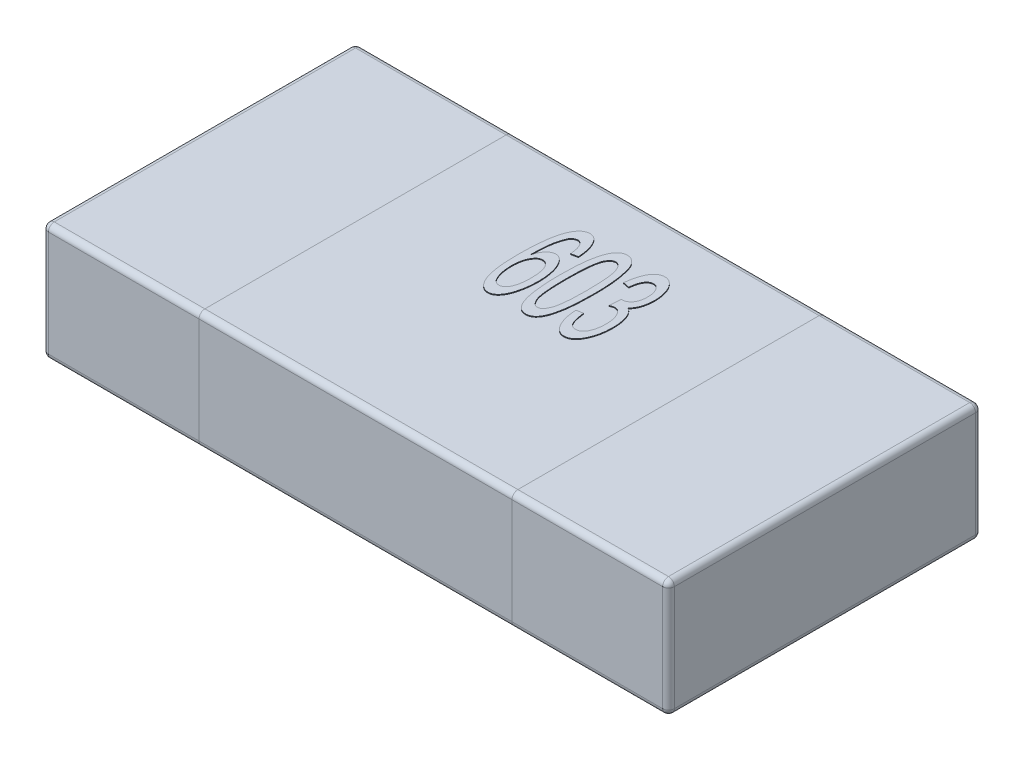
from build123d import *

# Parameters (mm, degrees)
SKETCH1_W      = 1.6
SKETCH1_H      = 0.8
EXTRUDE1_DEPTH = 0.3
FILLET1_R      = 0.015
EXTRUDE2_DEPTH = 0.002


with BuildPart() as part:
    # Sketch1 → Extrude1 (new body)
    with BuildSketch(Plane(origin=(0, 0, 0), x_dir=(1, 0, 0), z_dir=(0, 1, 0))):
        Rectangle(SKETCH1_W, SKETCH1_H)
    extrude(amount=EXTRUDE1_DEPTH)

    # Fillet1
    fillet1_edges = [part.edges().sort_by_distance(p)[0] for p in [
        (0.8, 0.3, 0),
        (0, 0.3, -0.4),
        (-0.8, 0.3, 0),
        (0, 0, -0.4),
        (0.8, 0, 0),
        (0, 0, 0.4),
        (-0.8, 0, 0),
        (0, 0.3, 0.4),
        (-0.8, 0.15, -0.4),
        (0.8, 0.15, -0.4),
        (0.8, 0.15, 0.4),
        (-0.8, 0.15, 0.4),
    ]]
    fillet(fillet1_edges, radius=FILLET1_R)

    # Sketch3 → Extrude2 (add)
    # profile 1 of 3: a face of its own
    with BuildSketch(Plane(origin=(0, 0.3, 0), x_dir=(1, 0, 0), z_dir=(0, 1, 0))):
        with BuildLine():
            Line((-0.036096661, 0.205977543), (-0.052560242, 0.202684827))
            add(Edge.make_bspline(
                [(-0.052560242, 0.202684827), (-0.052916238, 0.205500322), (-0.053578199, 0.210735634), (-0.054805569, 0.217971194), (-0.056350024, 0.223970927), (-0.057710724, 0.227458527), (-0.058322496, 0.229026557)],
                knots=[0, 0, 0, 0, 1.25871191, 2.340529116, 3.253899801, 4, 4, 4, 4], degree=3))
            add(Edge.make_bspline(
                [(-0.058322496, 0.229026557), (-0.058840285, 0.230062546), (-0.059826197, 0.232035155), (-0.061459633, 0.234760556), (-0.063271034, 0.237013087), (-0.065122747, 0.238914427), (-0.067090975, 0.240365286), (-0.069145695, 0.24144233), (-0.071319016, 0.242074823), (-0.072810043, 0.242156711), (-0.073551308, 0.242197422)],
                knots=[0, 0, 0, 0, 1.306213246, 2.487137382, 3.574554826, 4.559249402, 5.472188151, 6.319898977, 7.164736574, 8, 8, 8, 8], degree=3))
            add(Edge.make_bspline(
                [(-0.073551308, 0.242197422), (-0.07476618, 0.242107786), (-0.077278827, 0.241922398), (-0.080942431, 0.240323688), (-0.084612853, 0.237923041), (-0.086794531, 0.235744014), (-0.087956942, 0.234583016)],
                knots=[0, 0, 0, 0, 0.867949308, 1.795127324, 2.825230866, 4, 4, 4, 4], degree=3))
            add(Edge.make_bspline(
                [(-0.087956942, 0.234583016), (-0.088883615, 0.232763597), (-0.090885164, 0.228833778), (-0.093327859, 0.222137746), (-0.09569384, 0.214361846), (-0.097435328, 0.207108129), (-0.098743078, 0.200598815), (-0.099531474, 0.194978002), (-0.100244908, 0.188767584), (-0.100872077, 0.181976016), (-0.101308082, 0.174597013), (-0.10168483, 0.16662258), (-0.101869339, 0.158045302), (-0.1019232, 0.152127963), (-0.101950986, 0.14907529)],
                knots=[0, 0, 0, 0, 0.839911614, 1.814150845, 2.928592173, 4.18546405, 4.883305264, 5.661100017, 6.521068196, 7.456841163, 8.468429487, 9.563856538, 10.743227272, 12, 12, 12, 12], degree=3))
            add(Edge.make_bspline(
                [(-0.101950986, 0.14907529), (-0.100981266, 0.151766974), (-0.099142888, 0.156869817), (-0.095883014, 0.163875714), (-0.092224423, 0.169757395), (-0.08826603, 0.17454885), (-0.084068651, 0.178257141), (-0.07977594, 0.180948914), (-0.075317364, 0.182628825), (-0.072278537, 0.182829242), (-0.070773079, 0.182928529)],
                knots=[0, 0, 0, 0, 1.402270684, 2.658397633, 3.780438484, 4.789116074, 5.694730099, 6.51377897, 7.263714787, 8, 8, 8, 8], degree=3))
            add(Edge.make_bspline(
                [(-0.070773079, 0.182928529), (-0.069480331, 0.182857163), (-0.066883945, 0.182713828), (-0.063071578, 0.181604616), (-0.059485106, 0.179664998), (-0.055979674, 0.177128289), (-0.052718801, 0.173775203), (-0.049542654, 0.169772586), (-0.046586994, 0.165005793), (-0.043797521, 0.159574745), (-0.041183113, 0.153607508), (-0.038919576, 0.147140394), (-0.037025945, 0.140244694), (-0.035505037, 0.132919319), (-0.034258803, 0.125196618), (-0.033399298, 0.117038908), (-0.032876379, 0.10845497), (-0.03282845, 0.102583597), (-0.032803945, 0.099581649)],
                knots=[0, 0, 0, 0, 0.625603928, 1.256478042, 1.902851609, 2.592240709, 3.343949749, 4.15981504, 5.063070217, 6.054883205, 7.114906339, 8.215506121, 9.370060925, 10.575444375, 11.837083261, 13.156892884, 14.546360702, 16, 16, 16, 16], degree=3))
            add(Edge.make_bspline(
                [(-0.032803945, 0.099581649), (-0.032850682, 0.095617426), (-0.032942504, 0.08782929), (-0.03403992, 0.076357911), (-0.035638859, 0.065301191), (-0.037932498, 0.0547981), (-0.040756457, 0.045106297), (-0.044054038, 0.036461454), (-0.047891247, 0.029016938), (-0.052264038, 0.022856687), (-0.056982358, 0.017905703), (-0.062134763, 0.014354566), (-0.067642363, 0.01207195), (-0.071489984, 0.011828128), (-0.073396962, 0.011707284)],
                knots=[0, 0, 0, 0, 1.358661427, 2.669234055, 3.94728783, 5.187061561, 6.351710887, 7.405369735, 8.354785955, 9.214625863, 9.987975468, 10.685974054, 11.348735509, 12, 12, 12, 12], degree=3))
            add(Edge.make_bspline(
                [(-0.073396962, 0.011707284), (-0.075035193, 0.011798371), (-0.078281696, 0.011978879), (-0.083011275, 0.013373256), (-0.087447542, 0.015704858), (-0.091647133, 0.018906395), (-0.09564022, 0.022968277), (-0.099334051, 0.027985382), (-0.102813412, 0.033869295), (-0.106076879, 0.040674271), (-0.109014183, 0.048518609), (-0.111553474, 0.057485011), (-0.11369634, 0.06761075), (-0.115402755, 0.078901292), (-0.116786852, 0.091343464), (-0.117740633, 0.104954002), (-0.118292934, 0.119710594), (-0.118373046, 0.129935885), (-0.118414567, 0.135235592)],
                knots=[0, 0, 0, 0, 0.552617799, 1.095129805, 1.649413991, 2.236632648, 2.871359374, 3.566291345, 4.335003942, 5.176807573, 6.111491792, 7.159920783, 8.320743804, 9.604187918, 11.014329628, 12.547134295, 14.21040025, 16, 16, 16, 16], degree=3))
            add(Edge.make_bspline(
                [(-0.118414567, 0.135235592), (-0.118383327, 0.14118725), (-0.118323074, 0.152665905), (-0.11763298, 0.169255859), (-0.116586134, 0.184580864), (-0.115100659, 0.198653553), (-0.113255858, 0.211475597), (-0.110868853, 0.223025396), (-0.108207838, 0.233369508), (-0.105811451, 0.239676667), (-0.104677767, 0.24266046)],
                knots=[0, 0, 0, 0, 1.311918811, 2.530229781, 3.659611045, 4.697492828, 5.649171826, 6.513674335, 7.296848314, 8, 8, 8, 8], degree=3))
            add(Edge.make_bspline(
                [(-0.104677767, 0.24266046), (-0.103670777, 0.244960209), (-0.101754681, 0.24933616), (-0.098395926, 0.255320297), (-0.094780099, 0.260404284), (-0.090823353, 0.264520867), (-0.086661668, 0.267805335), (-0.082196842, 0.270172333), (-0.077405454, 0.27155828), (-0.074125923, 0.271740108), (-0.072470886, 0.271831868)],
                knots=[0, 0, 0, 0, 1.302959035, 2.479264578, 3.556888232, 4.533046998, 5.434321766, 6.298634537, 7.14139415, 8, 8, 8, 8], degree=3))
            add(Edge.make_bspline(
                [(-0.072470886, 0.271831868), (-0.071231113, 0.271789034), (-0.068791359, 0.271704741), (-0.065214001, 0.270829239), (-0.061819597, 0.269436687), (-0.058577599, 0.267513615), (-0.055589554, 0.264987155), (-0.052732722, 0.261974989), (-0.050061315, 0.258390048), (-0.047566135, 0.254282219), (-0.045258653, 0.249707538), (-0.04319491, 0.24468558), (-0.041417962, 0.239245226), (-0.039876535, 0.233383334), (-0.038545731, 0.227135374), (-0.037463978, 0.220456584), (-0.036655429, 0.213363881), (-0.036286181, 0.208482797), (-0.036096661, 0.205977543)],
                knots=[0, 0, 0, 0, 0.72398594, 1.42473555, 2.140052362, 2.864316225, 3.619526472, 4.42133265, 5.28803078, 6.229094356, 7.229502414, 8.28201401, 9.401785489, 10.574578382, 11.825867737, 13.136926968, 14.530506016, 16, 16, 16, 16], degree=3))
        make_face()
        with BuildLine():
            add(Edge.make_bspline(
                [(-0.101950986, 0.100250482), (-0.101924104, 0.097675728), (-0.101870947, 0.092584281), (-0.101062343, 0.085036357), (-0.100056853, 0.077631012), (-0.098455251, 0.070522494), (-0.096538086, 0.063945666), (-0.094423279, 0.058056664), (-0.091932097, 0.053061404), (-0.089316523, 0.048796777), (-0.086240722, 0.045461704), (-0.082757775, 0.043054332), (-0.078823864, 0.041586576), (-0.076050438, 0.041424591), (-0.074631731, 0.04134173)],
                knots=[0, 0, 0, 0, 1.31091918, 2.592277792, 3.863620146, 5.11633554, 6.299587734, 7.352780662, 8.298286836, 9.139203598, 9.893267991, 10.591138217, 11.27931686, 12, 12, 12, 12], degree=3))
            add(Edge.make_bspline(
                [(-0.074631731, 0.04134173), (-0.073648944, 0.041390981), (-0.071724611, 0.041487418), (-0.068930079, 0.042261399), (-0.066277889, 0.043427265), (-0.063839102, 0.045167588), (-0.061616591, 0.047392282), (-0.059476762, 0.050016973), (-0.057608866, 0.053199182), (-0.055855117, 0.056788927), (-0.0543503, 0.060818468), (-0.052937558, 0.065166106), (-0.0518388, 0.06990801), (-0.050840225, 0.074963046), (-0.050148946, 0.080379252), (-0.049630757, 0.086127965), (-0.049324155, 0.09222115), (-0.049286702, 0.096408639), (-0.049267526, 0.098552675)],
                knots=[0, 0, 0, 0, 0.688942626, 1.348976093, 2.022597512, 2.714060669, 3.437792542, 4.225685194, 5.084703878, 6.021697538, 7.027924231, 8.101756653, 9.229005186, 10.442766564, 11.718204999, 13.060110705, 14.494747648, 16, 16, 16, 16], degree=3))
            add(Edge.make_bspline(
                [(-0.049267526, 0.098552675), (-0.049286144, 0.100611042), (-0.049322472, 0.104627291), (-0.049637673, 0.110496735), (-0.05013548, 0.116025419), (-0.050858089, 0.121210613), (-0.051778825, 0.126054644), (-0.052897886, 0.130576791), (-0.054228499, 0.134758115), (-0.05577248, 0.138577961), (-0.057488692, 0.142028574), (-0.059451818, 0.145023464), (-0.061564343, 0.147592124), (-0.063907456, 0.149700086), (-0.066496005, 0.151300104), (-0.069264617, 0.152427404), (-0.072204414, 0.153217224), (-0.074248975, 0.153267978), (-0.075300564, 0.153294083)],
                knots=[0, 0, 0, 0, 1.478732979, 2.885278326, 4.221645226, 5.465767645, 6.644990639, 7.762613673, 8.810773448, 9.794608648, 10.720329775, 11.574669169, 12.361868475, 13.103694743, 13.828546177, 14.535586313, 15.246800971, 16, 16, 16, 16], degree=3))
            add(Edge.make_bspline(
                [(-0.075300564, 0.153294083), (-0.076215167, 0.153264412), (-0.078039831, 0.153205218), (-0.080686643, 0.152415784), (-0.083250725, 0.151288823), (-0.085685097, 0.149652878), (-0.088015119, 0.147585624), (-0.090171426, 0.14500143), (-0.092285489, 0.142016496), (-0.094991928, 0.137330259), (-0.097874399, 0.130593101), (-0.100229861, 0.121472417), (-0.101749343, 0.111242611), (-0.101881665, 0.10402935), (-0.101950986, 0.100250482)],
                knots=[0, 0, 0, 0, 0.50721352, 1.011907156, 1.524478714, 2.061771768, 2.63633205, 3.252202119, 3.930018688, 4.669826361, 6.259948316, 7.98914141, 9.898800059, 12, 12, 12, 12], degree=3))
        make_face(mode=Mode.SUBTRACT)
    # profile 2 of 3: a face of its own
    with BuildSketch(Plane(origin=(0, 0.3, 0), x_dir=(1, 0, 0), z_dir=(0, 1, 0))):
        with BuildLine():
            add(Edge.make_bspline(
                [(-0.01963308, 0.141666679), (-0.0196336, 0.145336921), (-0.01963462, 0.152524056), (-0.019338671, 0.163036587), (-0.019007755, 0.173020239), (-0.018487824, 0.18247128), (-0.017831025, 0.191391928), (-0.0170105, 0.199798121), (-0.016038147, 0.207673148), (-0.01491577, 0.215053), (-0.013609664, 0.221942574), (-0.012269607, 0.228397635), (-0.010631666, 0.234368012), (-0.008985003, 0.23991699), (-0.007101043, 0.245008279), (-0.005125272, 0.249651995), (-0.003016409, 0.253887417), (-0.00069761, 0.257618657), (0.00171757, 0.260980349), (0.004362167, 0.263835085), (0.007063973, 0.266380117), (0.010042242, 0.268311931), (0.013102296, 0.269892558), (0.016315504, 0.271035492), (0.019695286, 0.271729092), (0.022002776, 0.2717973), (0.023172232, 0.271831868)],
                knots=[0, 0, 0, 0, 1.788151203, 3.501590505, 5.123661968, 6.655046519, 8.113000155, 9.481534149, 10.769784636, 11.978715488, 13.117706418, 14.186263485, 15.189545838, 16.133154468, 17.005520955, 17.83278295, 18.59136407, 19.307915781, 19.971396443, 20.60428632, 21.201766662, 21.774181656, 22.327241785, 22.876946358, 23.430826444, 24, 24, 24, 24], degree=3))
            add(Edge.make_bspline(
                [(0.023172232, 0.271831868), (0.02489742, 0.271730261), (0.028365554, 0.271526), (0.033436322, 0.269931461), (0.038179705, 0.267181372), (0.042730219, 0.263593923), (0.046826031, 0.258957748), (0.050487109, 0.253444342), (0.053413024, 0.246934772), (0.055851925, 0.239571048), (0.057917698, 0.231350487), (0.059793333, 0.222297662), (0.061561708, 0.212402778), (0.062781594, 0.203568218), (0.063780502, 0.195940553), (0.064297629, 0.189619371), (0.064818017, 0.182811559), (0.065302136, 0.175524877), (0.065588826, 0.167752811), (0.065780113, 0.15950283), (0.065953973, 0.150756638), (0.065969539, 0.144753696), (0.065977543, 0.141666679)],
                knots=[0, 0, 0, 0, 0.698737742, 1.404667979, 2.12995161, 2.911751777, 3.743784079, 4.626968618, 5.585054768, 6.627217942, 7.768858967, 9.019282369, 10.374969805, 11.84297779, 12.634639747, 13.493234909, 14.413621191, 15.402885648, 16.453571879, 17.566351522, 18.748494617, 20, 20, 20, 20], degree=3))
            add(Edge.make_bspline(
                [(0.065977543, 0.141666679), (0.065978159, 0.138013585), (0.065979362, 0.130877887), (0.065683866, 0.120451066), (0.065349023, 0.110536192), (0.064834878, 0.101136305), (0.064173184, 0.092233069), (0.063353211, 0.083844319), (0.062389542, 0.075967503), (0.061239517, 0.068613544), (0.060041688, 0.061718903), (0.058565673, 0.055298878), (0.057068806, 0.049292549), (0.055352217, 0.043751556), (0.053514096, 0.038644463), (0.051503855, 0.033981437), (0.049430118, 0.029711033), (0.047075739, 0.025966705), (0.044691828, 0.022568395), (0.042054501, 0.019695347), (0.039301385, 0.017240817), (0.036408438, 0.015185704), (0.03329965, 0.013666592), (0.030067263, 0.012491487), (0.026664654, 0.011815784), (0.024341232, 0.011743601), (0.023172232, 0.011707284)],
                knots=[0, 0, 0, 0, 1.782030605, 3.480894169, 5.088281126, 6.621588788, 8.07303046, 9.443283057, 10.733151328, 11.943600354, 13.074282689, 14.145979223, 15.156496006, 16.093291734, 16.974611604, 17.802912475, 18.569920005, 19.28737156, 19.958446926, 20.592131586, 21.184778595, 21.755709941, 22.316934963, 22.867329855, 23.430111676, 24, 24, 24, 24], degree=3))
            add(Edge.make_bspline(
                [(0.023172232, 0.011707284), (0.021622309, 0.011792751), (0.018566274, 0.011961269), (0.014103824, 0.013116829), (0.009957796, 0.015110453), (0.00606522, 0.017874768), (0.002410954, 0.021382612), (-0.000910612, 0.025720225), (-0.004048152, 0.030755113), (-0.005766959, 0.034494046), (-0.006668009, 0.036454104)],
                knots=[0, 0, 0, 0, 0.902837177, 1.780155013, 2.665121303, 3.568842748, 4.551176045, 5.604575603, 6.744247641, 8, 8, 8, 8], degree=3))
            add(Edge.make_bspline(
                [(-0.006668009, 0.036454104), (-0.007728683, 0.039423115), (-0.009969715, 0.045696156), (-0.012473652, 0.055911974), (-0.014784141, 0.067263449), (-0.016504813, 0.079849027), (-0.017971067, 0.093605873), (-0.018884545, 0.108575532), (-0.0195315, 0.124717181), (-0.019598439, 0.135886533), (-0.01963308, 0.141666679)],
                knots=[0, 0, 0, 0, 0.709939903, 1.499988449, 2.366908435, 3.319380224, 4.360574811, 5.483543829, 6.697732639, 8, 8, 8, 8], degree=3))
        make_face()
        with BuildLine():
            add(Edge.make_bspline(
                [(-0.003169498, 0.141769576), (-0.003155073, 0.136830283), (-0.00312747, 0.127378965), (-0.002776126, 0.113878478), (-0.002162817, 0.101699054), (-0.001350557, 0.090873669), (-0.00038631, 0.081369297), (0.000962794, 0.073217333), (0.00244151, 0.066378302), (0.004194866, 0.060755793), (0.006247958, 0.056180954), (0.008251675, 0.05222923), (0.010496578, 0.048939222), (0.012731745, 0.046139662), (0.015171562, 0.043997946), (0.017726372, 0.042457926), (0.020418136, 0.041532712), (0.022256604, 0.041405224), (0.023172232, 0.04134173)],
                knots=[0, 0, 0, 0, 2.148209171, 4.110589266, 5.873159013, 7.451500976, 8.832018525, 10.026371285, 11.043326014, 11.87364374, 12.581766074, 13.222361835, 13.797470004, 14.311267183, 14.776476503, 15.201174402, 15.602154233, 16, 16, 16, 16], degree=3))
            add(Edge.make_bspline(
                [(0.023172232, 0.04134173), (0.024087316, 0.041406165), (0.025924693, 0.041535541), (0.028633345, 0.042449085), (0.031159233, 0.044057252), (0.033595097, 0.046185941), (0.035871262, 0.048927244), (0.038026135, 0.052250549), (0.040065479, 0.056188001), (0.042082893, 0.060820062), (0.043903713, 0.066439134), (0.04540722, 0.073297012), (0.046637216, 0.081465469), (0.047722003, 0.090954084), (0.048500412, 0.101768616), (0.049121855, 0.113912487), (0.049471924, 0.127396187), (0.049499516, 0.136830309), (0.049513962, 0.141769576)],
                knots=[0, 0, 0, 0, 0.397968213, 0.799071455, 1.227748287, 1.693100786, 2.201337741, 2.77249547, 3.413288389, 4.128472313, 4.968442944, 5.978433683, 7.179335303, 8.561103895, 10.132491914, 11.895604132, 13.851129669, 16, 16, 16, 16], degree=3))
            add(Edge.make_bspline(
                [(0.049513962, 0.141769576), (0.049500878, 0.146606023), (0.049475821, 0.155868822), (0.049106136, 0.169110662), (0.048551179, 0.181084137), (0.047812005, 0.191793744), (0.046802511, 0.201234544), (0.045573813, 0.209405715), (0.044212587, 0.216323276), (0.042462554, 0.222047621), (0.040612722, 0.226846565), (0.038513124, 0.230874839), (0.036406114, 0.234360491), (0.034048642, 0.237203159), (0.031549104, 0.239441387), (0.028847838, 0.241049155), (0.025980945, 0.242016447), (0.024002391, 0.242137291), (0.023017886, 0.242197422)],
                knots=[0, 0, 0, 0, 2.097667638, 4.017468331, 5.745104336, 7.296299201, 8.673017144, 9.86175774, 10.880024204, 11.727147521, 12.455080493, 13.107114618, 13.695308986, 14.218167368, 14.703088503, 15.143210123, 15.573671531, 16, 16, 16, 16], degree=3))
            add(Edge.make_bspline(
                [(0.023017886, 0.242197422), (0.02210265, 0.242152013), (0.020268471, 0.242061011), (0.017588327, 0.241181388), (0.015056215, 0.239768087), (0.01262728, 0.237811532), (0.010415289, 0.235255535), (0.00820768, 0.232231492), (0.006174796, 0.228633061), (0.005004618, 0.225984995), (0.004393459, 0.22460197)],
                knots=[0, 0, 0, 0, 0.80675324, 1.616773564, 2.464611733, 3.359239115, 4.357250525, 5.442463065, 6.664255618, 8, 8, 8, 8], degree=3))
            add(Edge.make_bspline(
                [(0.004393459, 0.22460197), (0.00378098, 0.22253435), (0.002456481, 0.218063076), (0.000977182, 0.210641303), (-0.000369781, 0.202081127), (-0.001344197, 0.192304543), (-0.002159651, 0.181359675), (-0.002771927, 0.169214683), (-0.003127491, 0.155885848), (-0.003155106, 0.146605983), (-0.003169498, 0.141769576)],
                knots=[0, 0, 0, 0, 0.619955473, 1.340667813, 2.174330384, 3.111791088, 4.165388337, 5.330978555, 6.608980495, 8, 8, 8, 8], degree=3))
        make_face(mode=Mode.SUBTRACT)
    # profile 3 of 3: a face of its own
    with BuildSketch(Plane(origin=(0, 0.3, 0), x_dir=(1, 0, 0), z_dir=(0, 1, 0))):
        with BuildLine():
            Line((0.079148408, 0.084147042), (0.09561199, 0.087439758))
            add(Edge.make_bspline(
                [(0.09561199, 0.087439758), (0.095833166, 0.085464918), (0.096259302, 0.081660042), (0.097183185, 0.076182527), (0.098061143, 0.071126657), (0.099105179, 0.066494388), (0.100234444, 0.062311455), (0.101382941, 0.058507911), (0.102747149, 0.05517901), (0.104103664, 0.052203183), (0.105672205, 0.049626635), (0.107418315, 0.047434539), (0.109277678, 0.045517631), (0.111370713, 0.044030316), (0.113611634, 0.042818016), (0.116020923, 0.041954285), (0.118602406, 0.041409233), (0.120373122, 0.041364674), (0.121284887, 0.04134173)],
                knots=[0, 0, 0, 0, 1.649108152, 3.177297497, 4.609664199, 5.908171696, 7.116720212, 8.206230621, 9.202780525, 10.100600141, 10.918461072, 11.698792213, 12.423518808, 13.126818764, 13.820983625, 14.532447604, 15.244338676, 16, 16, 16, 16], degree=3))
            add(Edge.make_bspline(
                [(0.121284887, 0.04134173), (0.122336057, 0.041370577), (0.124413201, 0.041427579), (0.127405346, 0.042202524), (0.130259712, 0.043324307), (0.132871824, 0.045007621), (0.135328423, 0.047085686), (0.137549435, 0.049644334), (0.139552397, 0.052669637), (0.142046903, 0.057358394), (0.144620692, 0.063981537), (0.14673822, 0.072737537), (0.148113632, 0.082337229), (0.148233278, 0.089046724), (0.14829545, 0.092533178)],
                knots=[0, 0, 0, 0, 0.591721462, 1.169259737, 1.733670427, 2.316457323, 2.913851876, 3.544882212, 4.221413764, 4.957633498, 6.539405675, 8.215619906, 10.033523363, 12, 12, 12, 12], degree=3))
            add(Edge.make_bspline(
                [(0.14829545, 0.092533178), (0.148210788, 0.095848067), (0.148048602, 0.102198377), (0.146707389, 0.111282834), (0.144496999, 0.119491199), (0.141761616, 0.12559798), (0.139305739, 0.129942817), (0.137274202, 0.132680106), (0.135166012, 0.135041055), (0.132890135, 0.136953823), (0.130504993, 0.138467579), (0.128001855, 0.139586867), (0.125345364, 0.140208978), (0.123534491, 0.14028881), (0.122622553, 0.140329013)],
                knots=[0, 0, 0, 0, 2.00661937, 3.8440676, 5.54744996, 7.137650372, 7.882240999, 8.565648834, 9.197898651, 9.794963822, 10.35972088, 10.903856529, 11.447992178, 12, 12, 12, 12], degree=3))
            add(Edge.make_bspline(
                [(0.122622553, 0.140329013), (0.121812576, 0.140287168), (0.120065532, 0.140196914), (0.117347773, 0.139452156), (0.114338363, 0.138385123), (0.11232242, 0.13736955), (0.111252392, 0.136830502)],
                knots=[0, 0, 0, 0, 0.80907589, 1.74509906, 2.803137832, 4, 4, 4, 4], degree=3))
            Line((0.111252392, 0.136830502), (0.113053096, 0.166464948))
            add(Edge.make_bspline(
                [(0.113053096, 0.166464948), (0.11353171, 0.166367497), (0.114382048, 0.166194358), (0.115247291, 0.166132047), (0.115625531, 0.166104807)],
                knots=[0, 0, 0, 0, 1.12570245, 2, 2, 2, 2], degree=3))
            add(Edge.make_bspline(
                [(0.115625531, 0.166104807), (0.117272472, 0.166225254), (0.120580306, 0.166467168), (0.125341911, 0.168429522), (0.129843683, 0.171469172), (0.133167187, 0.174986793), (0.135693375, 0.178285085), (0.137231938, 0.181260512), (0.138678919, 0.184484937), (0.139761242, 0.18807015), (0.14065766, 0.191970219), (0.141232549, 0.196189774), (0.141686388, 0.200720062), (0.141701979, 0.203849693), (0.141710017, 0.205463056)],
                knots=[0, 0, 0, 0, 1.125582491, 2.260699843, 3.480033264, 4.826666885, 5.557832413, 6.320538812, 7.115446949, 7.977966341, 8.881942553, 9.856105228, 10.894795932, 12, 12, 12, 12], degree=3))
            add(Edge.make_bspline(
                [(0.141710017, 0.205463056), (0.141658193, 0.208006974), (0.141558812, 0.21288524), (0.140327396, 0.219843774), (0.13846107, 0.22614926), (0.135816014, 0.231679174), (0.132609362, 0.236288516), (0.128811785, 0.239691462), (0.124465921, 0.24182039), (0.121358957, 0.242071067), (0.119792875, 0.242197422)],
                knots=[0, 0, 0, 0, 1.293710212, 2.480844353, 3.585649614, 4.63226768, 5.58943552, 6.424791909, 7.206007201, 8, 8, 8, 8], degree=3))
            add(Edge.make_bspline(
                [(0.119792875, 0.242197422), (0.118246919, 0.242081541), (0.115159328, 0.241850103), (0.110791673, 0.23984828), (0.106910151, 0.236633272), (0.10349501, 0.232201283), (0.100649165, 0.226533137), (0.098302071, 0.219684515), (0.096592299, 0.211596472), (0.095952392, 0.205779301), (0.09561199, 0.202684827)],
                knots=[0, 0, 0, 0, 0.730108995, 1.458178259, 2.232698473, 3.101191617, 4.090237344, 5.226680697, 6.524718881, 8, 8, 8, 8], degree=3))
            Line((0.09561199, 0.202684827), (0.079148408, 0.205977543))
            add(Edge.make_bspline(
                [(0.079148408, 0.205977543), (0.079422632, 0.208517791), (0.079957444, 0.213471986), (0.081026568, 0.220668345), (0.082349567, 0.22742041), (0.0839637, 0.23371328), (0.085731359, 0.239587095), (0.087798497, 0.24501793), (0.090102828, 0.250004185), (0.09262595, 0.254546929), (0.09531784, 0.258628423), (0.098261096, 0.26212196), (0.101319031, 0.265125765), (0.104580654, 0.267548777), (0.107988298, 0.269495503), (0.111604057, 0.270834943), (0.11536176, 0.271697888), (0.117936064, 0.271787122), (0.119226939, 0.271831868)],
                knots=[0, 0, 0, 0, 1.459596317, 2.84662182, 4.15515777, 5.388463855, 6.556859207, 7.657740383, 8.705408786, 9.692257951, 10.624329051, 11.49367949, 12.297450401, 13.067553204, 13.808884779, 14.531329162, 15.263540318, 16, 16, 16, 16], degree=3))
            add(Edge.make_bspline(
                [(0.119226939, 0.271831868), (0.12100532, 0.271717357), (0.12458628, 0.271486776), (0.129821311, 0.269761218), (0.134777222, 0.266893256), (0.139435755, 0.263000822), (0.143751463, 0.258205699), (0.147571454, 0.252544229), (0.150819845, 0.246054037), (0.153394946, 0.238840613), (0.155586525, 0.231185982), (0.157028093, 0.223168698), (0.158005059, 0.214936606), (0.158117063, 0.209358918), (0.158173599, 0.206543479)],
                knots=[0, 0, 0, 0, 0.766504606, 1.54343929, 2.35204212, 3.224643751, 4.151972829, 5.12685525, 6.162656569, 7.27470821, 8.427354631, 9.594212267, 10.785635087, 12, 12, 12, 12], degree=3))
            add(Edge.make_bspline(
                [(0.158173599, 0.206543479), (0.158129793, 0.203883133), (0.158043938, 0.198669113), (0.157207752, 0.191045821), (0.155818746, 0.183782651), (0.153886857, 0.176944626), (0.15146162, 0.17058129), (0.148396002, 0.164897215), (0.144884665, 0.159815365), (0.142029819, 0.156993381), (0.140629595, 0.155609274)],
                knots=[0, 0, 0, 0, 1.152706571, 2.259193037, 3.31898162, 4.354271797, 5.335674599, 6.263484264, 7.148286381, 8, 8, 8, 8], degree=3))
            add(Edge.make_bspline(
                [(0.140629595, 0.155609274), (0.141550019, 0.155132057), (0.143421499, 0.15416174), (0.146046947, 0.152309286), (0.148454621, 0.150041625), (0.150824794, 0.147540326), (0.152877037, 0.144554406), (0.154945403, 0.14132349), (0.156682056, 0.137640382), (0.159030696, 0.132255326), (0.16138939, 0.124730583), (0.163370585, 0.114833688), (0.164533038, 0.103896571), (0.164681599, 0.096257501), (0.164759031, 0.092275935)],
                knots=[0, 0, 0, 0, 0.52525004, 1.067981336, 1.621810324, 2.200206439, 2.810646633, 3.454824552, 4.143024852, 4.871351741, 6.433032383, 8.127849685, 9.981793062, 12, 12, 12, 12], degree=3))
            add(Edge.make_bspline(
                [(0.164759031, 0.092275935), (0.164716643, 0.089513919), (0.16463362, 0.084104062), (0.16406697, 0.076151026), (0.163101736, 0.068521557), (0.161698188, 0.061209213), (0.159971168, 0.054187875), (0.157803242, 0.04750756), (0.155283758, 0.041137168), (0.152379773, 0.035166706), (0.149189942, 0.029724109), (0.145795947, 0.024907517), (0.142127427, 0.020890176), (0.138299011, 0.017513369), (0.134197002, 0.01491831), (0.129901344, 0.013037079), (0.125372856, 0.011905228), (0.122285945, 0.011773932), (0.120718951, 0.011707284)],
                knots=[0, 0, 0, 0, 1.319392664, 2.58424548, 3.806679826, 4.990851303, 6.139315794, 7.258538614, 8.343227405, 9.409443559, 10.426694767, 11.354289356, 12.218389751, 13.01991192, 13.785851927, 14.52703166, 15.252283965, 16, 16, 16, 16], degree=3))
            add(Edge.make_bspline(
                [(0.120718951, 0.011707284), (0.119305688, 0.011758074), (0.116512481, 0.011858458), (0.112453586, 0.012922904), (0.108535792, 0.014434623), (0.104861886, 0.016723242), (0.101321294, 0.019561242), (0.098061955, 0.023120057), (0.094880675, 0.027202062), (0.091992155, 0.031932407), (0.089357898, 0.03716463), (0.086914316, 0.042763328), (0.08487547, 0.048761085), (0.08313158, 0.055122846), (0.081642389, 0.061851601), (0.080451215, 0.068958465), (0.079652074, 0.076434263), (0.079318725, 0.081538936), (0.079148408, 0.084147042)],
                knots=[0, 0, 0, 0, 0.742796888, 1.468081041, 2.197852687, 2.947757842, 3.737888764, 4.581524504, 5.483240962, 6.460997659, 7.495341527, 8.567730215, 9.676270629, 10.829167895, 12.041319962, 13.305256957, 14.62318817, 16, 16, 16, 16], degree=3))
        make_face()
    extrude(amount=EXTRUDE2_DEPTH)


solid = part.part
